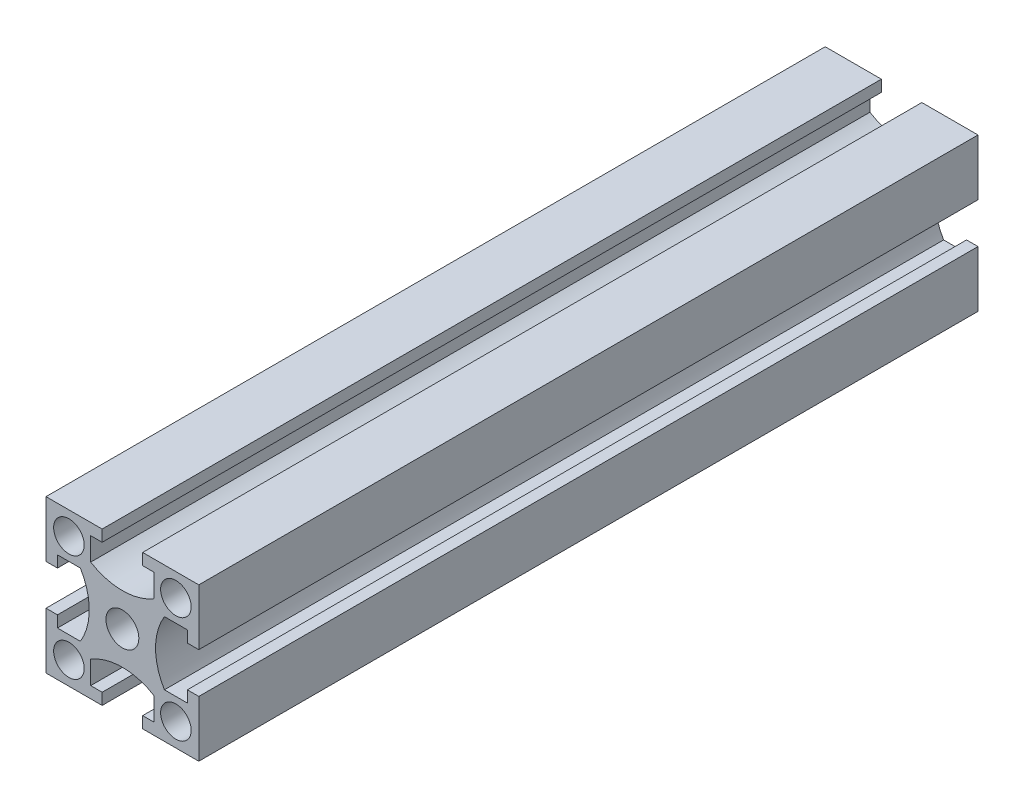
from build123d import *

# Parameters (mm, degrees)
SKETCH_1_W          = 20
SKETCH_1_H          = 20
EXTRUDE_1_DEPTH     = 102
SKETCH_2_R          = 2.15
SKETCH_2_R_2        = 2
CUT_EXTRUDE_1_DEPTH = 300


with BuildPart() as part:
    # 스케치1 → 보스-돌출1 (new body)
    with BuildSketch(Plane.XY):
        Rectangle(SKETCH_1_W, SKETCH_1_H)
    extrude(amount=EXTRUDE_1_DEPTH)

    # 스케치2 → 컷-돌출1 (cut)
    with BuildSketch(Plane.XY.offset(102)):
        Circle(SKETCH_2_R)
        with Locations((-7, 7)):
            Circle(SKETCH_2_R_2)
        with Locations((7, 7)):
            Circle(SKETCH_2_R_2)
        with Locations((7, -7)):
            Circle(SKETCH_2_R_2)
        with Locations((-7, -7)):
            Circle(SKETCH_2_R_2)
        with BuildLine():
            Line((-2.65, 10), (-2.65, 8.5))
            Line((-2.65, 8.5), (-4.15, 8.5))
            Line((-4.15, 8.5), (-4.15, 5.5))
            ThreePointArc((-4.15, 5.5), (0, 4.339407869), (4.15, 5.5))
            Line((4.15, 5.5), (4.15, 8.5))
            Line((4.15, 8.5), (2.65, 8.5))
            Line((2.65, 8.5), (2.65, 10))
            Line((2.65, 10), (-2.65, 10))
        make_face()
        with BuildLine():
            Line((10, 2.65), (8.5, 2.65))
            Line((8.5, 2.65), (8.5, 4.15))
            Line((8.5, 4.15), (5.5, 4.15))
            ThreePointArc((5.5, 4.15), (4.339407869, 0), (5.5, -4.15))
            Line((5.5, -4.15), (8.5, -4.15))
            Line((8.5, -4.15), (8.5, -2.65))
            Line((8.5, -2.65), (10, -2.65))
            Line((10, -2.65), (10, 2.65))
        make_face()
        with BuildLine():
            Line((2.65, -10), (2.65, -8.5))
            Line((2.65, -8.5), (4.15, -8.5))
            Line((4.15, -8.5), (4.15, -5.5))
            ThreePointArc((4.15, -5.5), (0, -4.339407869), (-4.15, -5.5))
            Line((-4.15, -5.5), (-4.15, -8.5))
            Line((-4.15, -8.5), (-2.65, -8.5))
            Line((-2.65, -8.5), (-2.65, -10))
            Line((-2.65, -10), (2.65, -10))
        make_face()
        with BuildLine():
            Line((-10, -2.65), (-8.5, -2.65))
            Line((-8.5, -2.65), (-8.5, -4.15))
            Line((-8.5, -4.15), (-5.5, -4.15))
            ThreePointArc((-5.5, -4.15), (-4.339407869, 0), (-5.5, 4.15))
            Line((-5.5, 4.15), (-8.5, 4.15))
            Line((-8.5, 4.15), (-8.5, 2.65))
            Line((-8.5, 2.65), (-10, 2.65))
            Line((-10, 2.65), (-10, -2.65))
        make_face()
    extrude(amount=-CUT_EXTRUDE_1_DEPTH, mode=Mode.SUBTRACT)


solid = part.part
